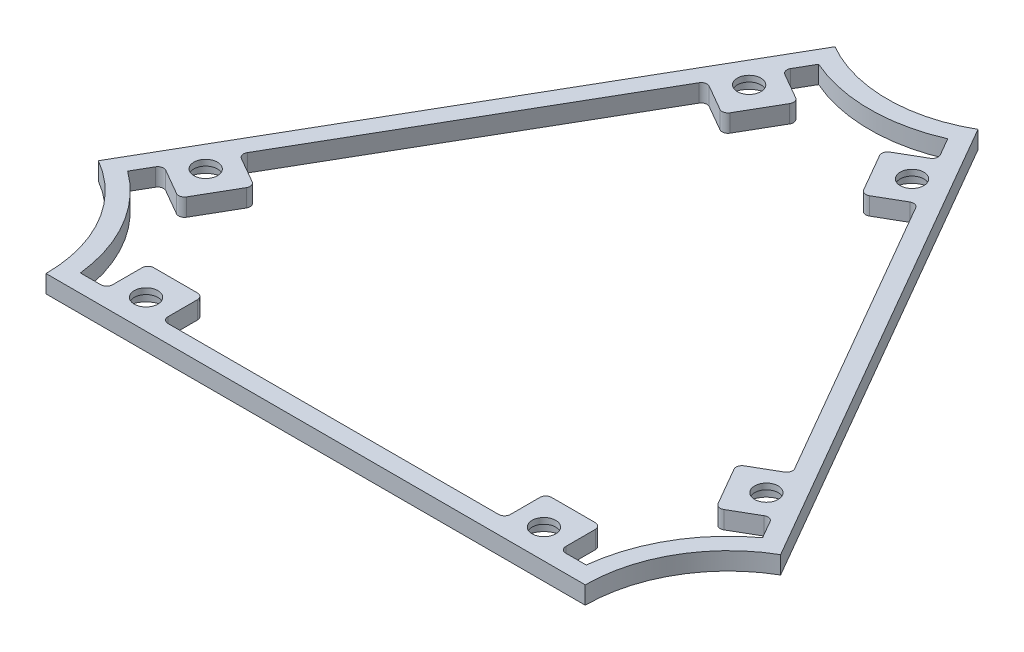
from build123d import *

# Parameters (mm, degrees)
BOSS_EXTRUDE2_DEPTH = 3
SKETCH3_R           = 2.0000000000000036
SKETCH3_R_2         = 1.9999999999999967
SKETCH3_R_3         = 2.0000000000000027
SKETCH3_R_4         = 2.0000000000000018
CUT_EXTRUDE1_DEPTH  = 84.32734015621716
FILLET2_R           = 1
SKETCH5_R           = 3.299999999999997
SKETCH5_R_2         = 3.3000000000000003
SKETCH5_R_3         = 3.2999999999998377
CUT_EXTRUDE3_DEPTH  = 2


with BuildPart() as part:
    # Sketch2 → Boss-Extrude2 (new body)
    with BuildSketch(Plane(origin=(0, 0, 0), x_dir=(1, 0, 0), z_dir=(0, 1, 0))):
        with BuildLine():
            Line((-57.900347822426866, -19.41320198612938), (-45.90034782242687, 1.3714077046971502))
            Line((-45.90034782242687, 1.3714077046971502), (-24.137847822426874, 39.065163404414825))
            Line((-24.137847822426874, 39.065163404414825), (-12.137847822426867, 59.849773095241346))
            ThreePointArc((-12.137847822426867, 59.849773095241346), (-2.0632e-13, 56.59744657337059), (12.137847822426314, 59.849773095241474))
            Line((12.137847822426314, 59.849773095241474), (24.13784782242651, 39.06516340441507))
            Line((24.13784782242651, 39.06516340441507), (45.90034782242685, 1.3714077046975783))
            Line((45.90034782242685, 1.3714077046975783), (57.90034782242704, -19.413201986128836))
            ThreePointArc((57.90034782242704, -19.413201986128836), (49.014826521872, -28.298723286684716), (45.76250000000075, -40.43657110911115))
            Line((45.76250000000075, -40.43657110911115), (21.762500000000745, -40.43657110911158))
            Line((21.762500000000745, -40.43657110911158), (-21.762499999999243, -40.436571109112386))
            Line((-21.762499999999243, -40.436571109112386), (-45.762499999999235, -40.43657110911281))
            ThreePointArc((-45.762499999999235, -40.43657110911281), (-49.01482652187049, -28.298723286685338), (-57.900347822426866, -19.41320198612938))
        make_face()
        with BuildLine():
            Line((11.82759378458235, 40.3871488520415), (11.32759378458234, 41.25317425582594))
            Line((11.32759378458234, 41.25317425582594), (7.1275937845823325, 48.52778764761524))
            Line((7.1275937845823325, 48.52778764761524), (13.189771611073091, 52.02778764761513))
            Line((13.189771611073091, 52.02778764761513), (10.95702958785254, 55.895010272027164))
            ThreePointArc((10.95702958785254, 55.895010272027164), (-3.1e-14, 53.59744657337001), (-10.95702958785254, 55.895010272027164))
            Line((-10.95702958785254, 55.895010272027164), (-13.189771611074285, 52.0277876476148))
            Line((-13.189771611074285, 52.0277876476148), (-7.127593784582693, 48.52778764761462))
            Line((-7.127593784582693, 48.52778764761462), (-11.327593784582492, 41.25317425582568))
            Line((-11.327593784582492, 41.25317425582568), (-11.827593784582703, 40.38714885204087))
            Line((-11.827593784582703, 40.38714885204087), (-17.889771611074185, 43.88714885204099))
            Line((-17.889771611074185, 43.88714885204099), (-21.53977161107411, 37.56516340441455))
            Line((-21.53977161107411, 37.56516340441455), (-43.30227161107358, -0.12859229530344518))
            Line((-43.30227161107358, -0.12859229530344518), (-46.95227161107352, -6.450577742929913))
            Line((-46.95227161107352, -6.450577742929913), (-40.890093784582575, -9.950577742929706))
            Line((-40.890093784582575, -9.950577742929706), (-45.59009378458257, -18.091216538503463))
            Line((-45.59009378458257, -18.091216538503463), (-51.65227161107341, -14.591216538503707))
            Line((-51.65227161107341, -14.591216538503707), (-53.88501363429374, -18.458439162915578))
            ThreePointArc((-53.88501363429374, -18.458439162915578), (-46.4167503105172, -26.798723286685323), (-42.92798404644063, -37.43657110911222))
            Line((-42.92798404644063, -37.43657110911222), (-38.46249999999932, -37.436571109112705))
            Line((-38.46249999999932, -37.436571109112705), (-38.46249999999945, -30.436571109112176))
            Line((-38.46249999999945, -30.436571109112176), (-30.062499999999865, -30.436571109112133))
            Line((-30.062499999999865, -30.436571109112133), (-29.062499999999424, -30.43657110911213))
            Line((-29.062499999999424, -30.43657110911213), (-29.062499999999286, -37.43657110911253))
            Line((-29.062499999999286, -37.43657110911253), (-21.762499999999292, -37.43657110911241))
            Line((-21.762499999999292, -37.43657110911241), (21.762500000000696, -37.4365711091116))
            Line((21.762500000000696, -37.4365711091116), (29.062500000000714, -37.436571109111476))
            Line((29.062500000000714, -37.436571109111476), (29.062500000000565, -30.436571109111707))
            Line((29.062500000000565, -30.436571109111707), (38.46250000000059, -30.436571109111636))
            Line((38.46250000000059, -30.436571109111636), (38.46250000000072, -37.436571109111306))
            Line((38.46250000000072, -37.436571109111306), (42.927984046442106, -37.43657110911252))
            ThreePointArc((42.927984046442106, -37.43657110911252), (46.41675031051867, -26.798723286684776), (53.88501363429554, -18.458439162914214))
            Line((53.88501363429554, -18.458439162914214), (51.65227161107371, -14.591216538502506))
            Line((51.65227161107371, -14.591216538502506), (45.59009378458266, -18.09121653850257))
            Line((45.59009378458266, -18.09121653850257), (40.890093784582604, -9.950577742928846))
            Line((40.890093784582604, -9.950577742928846), (46.95227161107361, -6.450577742928804))
            Line((46.95227161107361, -6.450577742928804), (43.30227161107357, -0.12859229530243052))
            Line((43.30227161107357, -0.12859229530243052), (21.539771611073228, 37.565163404415046))
            Line((21.539771611073228, 37.565163404415046), (17.88977161107317, 43.88714885204144))
            Line((17.88977161107317, 43.88714885204144), (11.82759378458235, 40.3871488520415))
        make_face(mode=Mode.SUBTRACT)
    extrude(amount=BOSS_EXTRUDE2_DEPTH)

    # Sketch3 → Cut-Extrude1 (cut, through all)
    with BuildSketch(Plane(origin=(0, 3, 0), x_dir=(1, 0, 0), z_dir=(0, 1, 0))):
        with Locations(Location((33.762500000000074, -35.45259651289613, 0), (0, 0, 270))):
            Circle(SKETCH3_R)
        with Locations(Location((-33.76249999999959, -35.45259651289661, 0), (0, 0, 270))):
            Circle(SKETCH3_R_2)
        with Locations(Location((-47.58409921028776, -11.5128844388239, 0), (0, 0, 270))):
            Circle(SKETCH3_R_3)
        with Locations(Location((47.58409921028791, -11.512884438823233, 0), (0, 0, 270))):
            Circle(SKETCH3_R_3)
        with Locations(Location((13.821599210288047, 46.96548095172012, 0), (0, 0, 270))):
            Circle(SKETCH3_R)
        with Locations(Location((-13.821599210288047, 46.96548095172012, 0), (0, 0, 270))):
            Circle(SKETCH3_R_4)
    extrude(amount=-CUT_EXTRUDE1_DEPTH, mode=Mode.SUBTRACT)

    # Fillet2
    fillet2_edges = [part.edges().sort_by_distance(p)[0] for p in [
        (-46.95227161107352, 1.5, 6.450577742929913),
        (-40.890093784582575, 1.5, 9.950577742929706),
        (-45.59009378458257, 1.5, 18.091216538503463),
        (-51.65227161107341, 1.5, 14.591216538503707),
        (-38.46249999999932, 1.5, 37.436571109112705),
        (-38.46249999999945, 1.5, 30.436571109112176),
        (-29.062499999999424, 1.5, 30.43657110911213),
        (-29.062499999999286, 1.5, 37.43657110911253),
        (29.062500000000714, 1.5, 37.436571109111476),
        (29.062500000000565, 1.5, 30.436571109111707),
        (38.46250000000059, 1.5, 30.436571109111636),
        (38.46250000000072, 1.5, 37.436571109111306),
        (51.65227161107371, 1.5, 14.591216538502506),
        (45.59009378458266, 1.5, 18.09121653850257),
        (40.890093784582604, 1.5, 9.950577742928846),
        (46.95227161107361, 1.5, 6.450577742928804),
        (17.88977161107317, 1.5, -43.88714885204144),
        (11.82759378458235, 1.5, -40.3871488520415),
        (7.1275937845823325, 1.5, -48.52778764761524),
        (13.189771611073091, 1.5, -52.02778764761513),
        (-13.189771611074285, 1.5, -52.0277876476148),
        (-7.127593784582693, 1.5, -48.52778764761462),
        (-11.827593784582703, 1.5, -40.38714885204087),
        (-17.889771611074185, 1.5, -43.88714885204099),
    ]]
    fillet(fillet2_edges, radius=FILLET2_R)

    # Sketch5 → Cut-Extrude3 (cut)
    with BuildSketch(Plane.XZ):
        with Locations(Location((47.58409921028791, 11.512884438823233, 0), (0, 0, 270))):
            Circle(SKETCH5_R)
        with Locations(Location((33.762500000000074, 35.45259651289613, 0), (0, 0, 270))):
            Circle(SKETCH5_R)
        with Locations(Location((-13.821599210288472, -46.96548095172, 0), (0, 0, 270))):
            Circle(SKETCH5_R_2)
        with Locations(Location((13.821599210287625, -46.96548095172023, 0), (0, 0, 270))):
            Circle(SKETCH5_R_2)
        with Locations(Location((-33.76249999999945, 35.45259651289674, 0), (0, 0, 270))):
            Circle(SKETCH5_R)
        with Locations(Location((-47.5840992102877, 11.512884438824086, 0), (0, 0, 270))):
            Circle(SKETCH5_R_3)
    extrude(amount=-CUT_EXTRUDE3_DEPTH, mode=Mode.SUBTRACT)


solid = part.part
